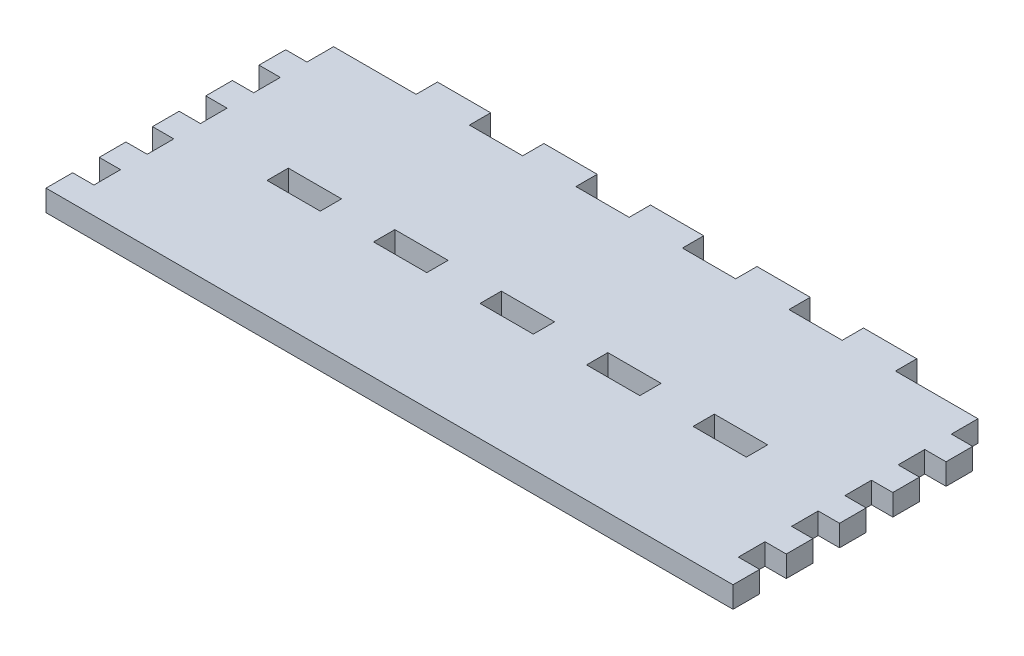
from build123d import *

# Parameters (mm, degrees)
SKETCH1_W           = 121
SKETCH1_H           = 50
BOSS_EXTRUDE1_DEPTH = 4
SKETCH2_W           = 4
SKETCH2_H           = 5
BOSS_EXTRUDE2_DEPTH = 4
LPATTERN1_COUNT     = 5
LPATTERN1_PITCH     = 10
SKETCH3_W           = 10
SKETCH3_H           = 4
BOSS_EXTRUDE3_DEPTH = 4
LPATTERN2_COUNT     = 3
LPATTERN2_PITCH     = 20
LPATTERN2_COL_COUNT = 3
LPATTERN2_COL_PITCH = 20
SKETCH4_W           = 10
SKETCH4_H           = 4
CUT_EXTRUDE1_DEPTH  = 135.688529578


with BuildPart() as part:
    # Sketch1 → Boss-Extrude1 (new body)
    with BuildSketch(Plane(origin=(0, 0, 0), x_dir=(1, 0, 0), z_dir=(0, 1, 0))):
        with Locations((60.5, -25)):
            Rectangle(SKETCH1_W, SKETCH1_H)
    extrude(amount=BOSS_EXTRUDE1_DEPTH)

    # Sketch2 → Boss-Extrude2 (add, through all)
    with BuildSketch(Plane(origin=(0, 0, 0), x_dir=(-1, 0, 0), z_dir=(0, -1, 0))):
        with Locations((2, -47.5)):
            Rectangle(SKETCH2_W, SKETCH2_H)
        with Locations((-123, -47.5)):
            Rectangle(SKETCH2_W, SKETCH2_H)
    boss_extrude2 = extrude(amount=-BOSS_EXTRUDE2_DEPTH)

    # LPattern1: Boss-Extrude2 ×5
    with Locations(*[(0, 0, -i * LPATTERN1_PITCH) for i in range(1, LPATTERN1_COUNT)]):
        add(boss_extrude2)

    # Sketch3 → Boss-Extrude3 (add, through all)
    with BuildSketch(Plane(origin=(0, 0, 0), x_dir=(-1, 0, 0), z_dir=(0, -1, 0))):
        with Locations((-60.5, 2)):
            Rectangle(SKETCH3_W, SKETCH3_H)
    boss_extrude3 = extrude(amount=-BOSS_EXTRUDE3_DEPTH)

    # LPattern2: Boss-Extrude3 ×3
    with Locations(*[(i * LPATTERN2_PITCH, 0, 0) for i in range(1, LPATTERN2_COUNT)]):
        add(boss_extrude3)

    # LPattern2 col: Boss-Extrude3 ×3
    with Locations(*[(-i * LPATTERN2_COL_PITCH, 0, 0) for i in range(1, LPATTERN2_COL_COUNT)]):
        add(boss_extrude3)

    # Sketch4 → Cut-Extrude1 (cut, through all)
    with BuildSketch(Plane.XZ):
        with Locations((20.5, 26)):
            Rectangle(SKETCH4_W, SKETCH4_H)
        with Locations((40.5, 26)):
            Rectangle(SKETCH4_W, SKETCH4_H)
        with Locations((60.5, 26)):
            Rectangle(SKETCH4_W, SKETCH4_H)
        with Locations((80.5, 26)):
            Rectangle(SKETCH4_W, SKETCH4_H)
        with Locations((100.5, 26)):
            Rectangle(SKETCH4_W, SKETCH4_H)
    extrude(amount=-CUT_EXTRUDE1_DEPTH, mode=Mode.SUBTRACT)


solid = part.part
